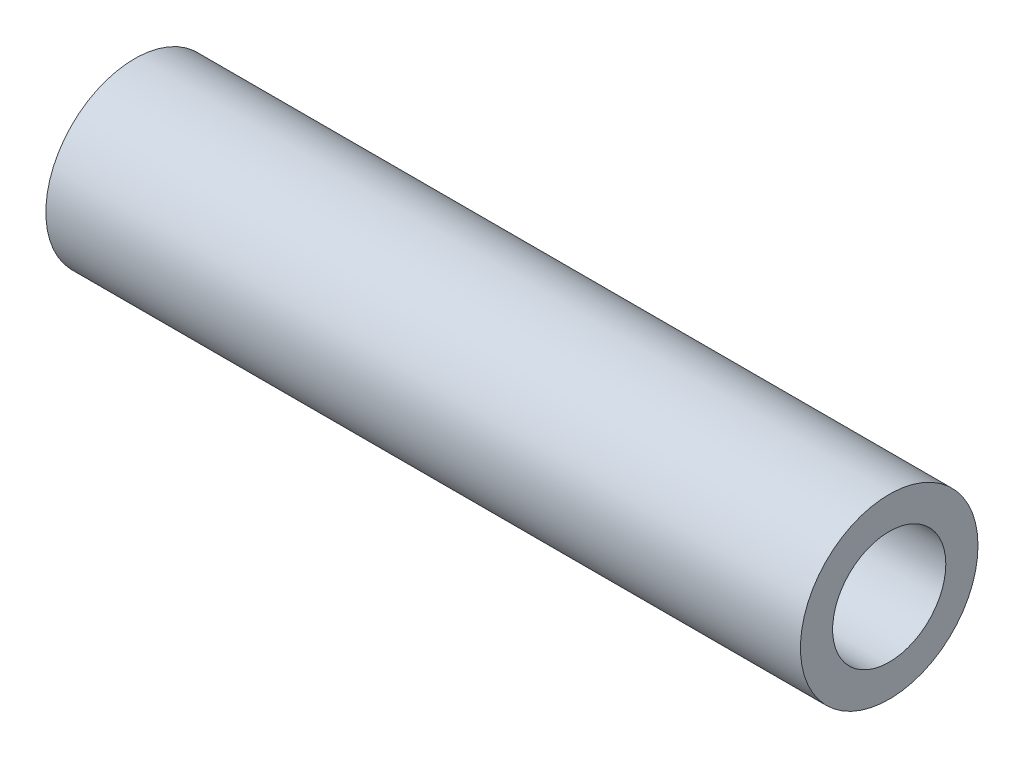
from build123d import *

# Parameters (mm, degrees)
SKETCH1_R           = 4
SKETCH1_R_2         = 2.55
BOSS_EXTRUDE1_DEPTH = 34


with BuildPart() as part:
    # Sketch1 → Boss-Extrude1 (new body)
    with BuildSketch(Plane(origin=(0, 0, 0), x_dir=(0, 0, -1), z_dir=(1, 0, 0))):
        Circle(SKETCH1_R)
        Circle(SKETCH1_R_2, mode=Mode.SUBTRACT)
    extrude(amount=BOSS_EXTRUDE1_DEPTH)


solid = part.part
